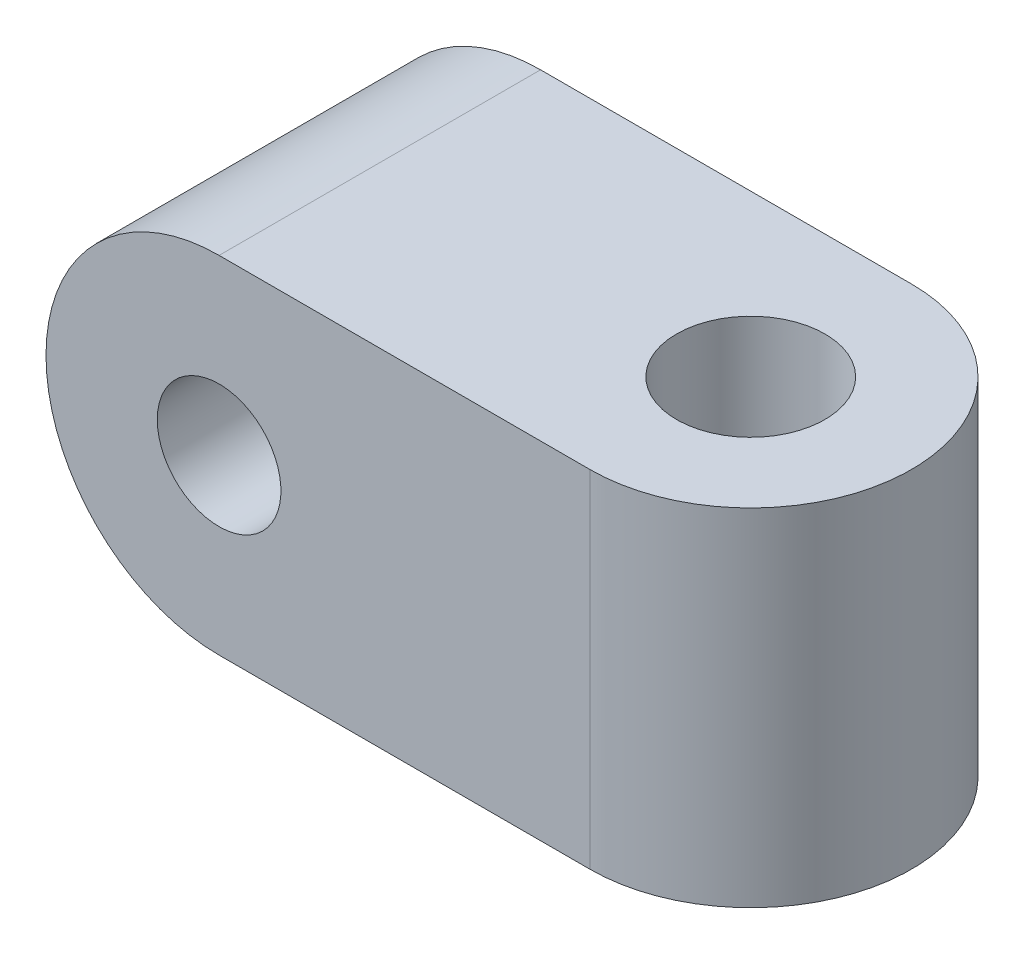
from build123d import *

# Parameters (mm, degrees)
SKETCH_1_R      = 3.5
SKETCH_1_R_2    = 1.25
EXTRUDE_1_DEPTH = 6.5
SKETCH_2_R      = 3.25
SKETCH_2_R_2    = 1.5
EXTRUDE_2_DEPTH = 7


with BuildPart() as part:
    # Эскиз1 → Бобышка-Вытянуть1 (new body)
    # profile 1 of 3: a face of its own
    with BuildSketch(Plane.XY):
        Circle(SKETCH_1_R)
        with Locations(Location((0, 0, 0), (0, 0, 180))):
            Circle(SKETCH_1_R_2, mode=Mode.SUBTRACT)
    # profile 2 of 3: a face of its own
    with BuildSketch(Plane.XY):
        with BuildLine():
            Line((3.5, 3.5), (0, 3.5))
            ThreePointArc((0, 3.5), (2.474873734, 2.474873734), (3.5, 0))
            Line((3.5, 0), (3.5, 3.5))
        make_face()
    # profile 3 of 3: a face of its own
    with BuildSketch(Plane.XY):
        with BuildLine():
            Line((3.5, -3.5), (3.5, 0))
            ThreePointArc((3.5, 0), (2.474873734, -2.474873734), (0, -3.5))
            Line((0, -3.5), (3.5, -3.5))
        make_face()
    extrude(amount=EXTRUDE_1_DEPTH)

    # Эскиз2 → Бобышка-Вытянуть2 (add)
    # profile 1 of 2: a face of its own
    with BuildSketch(Plane(origin=(0, 3.5, 0), x_dir=(1, 0, 0), z_dir=(0, 1, 0))):
        with BuildLine():
            ThreePointArc((7.5, -6.5), (4.25, -3.25), (7.5, 0))
            Line((7.5, 0), (3.5, 0))
            Line((3.5, 0), (3.5, -6.5))
            Line((3.5, -6.5), (7.5, -6.5))
        make_face()
    # profile 2 of 2: a face of its own
    with BuildSketch(Plane(origin=(0, 3.5, 0), x_dir=(1, 0, 0), z_dir=(0, 1, 0))):
        with Locations((7.5, -3.25)):
            Circle(SKETCH_2_R)
        with Locations(Location((7.5, -3.25, 0), (0, 0, 180))):
            Circle(SKETCH_2_R_2, mode=Mode.SUBTRACT)
    extrude(amount=-EXTRUDE_2_DEPTH)


solid = part.part
